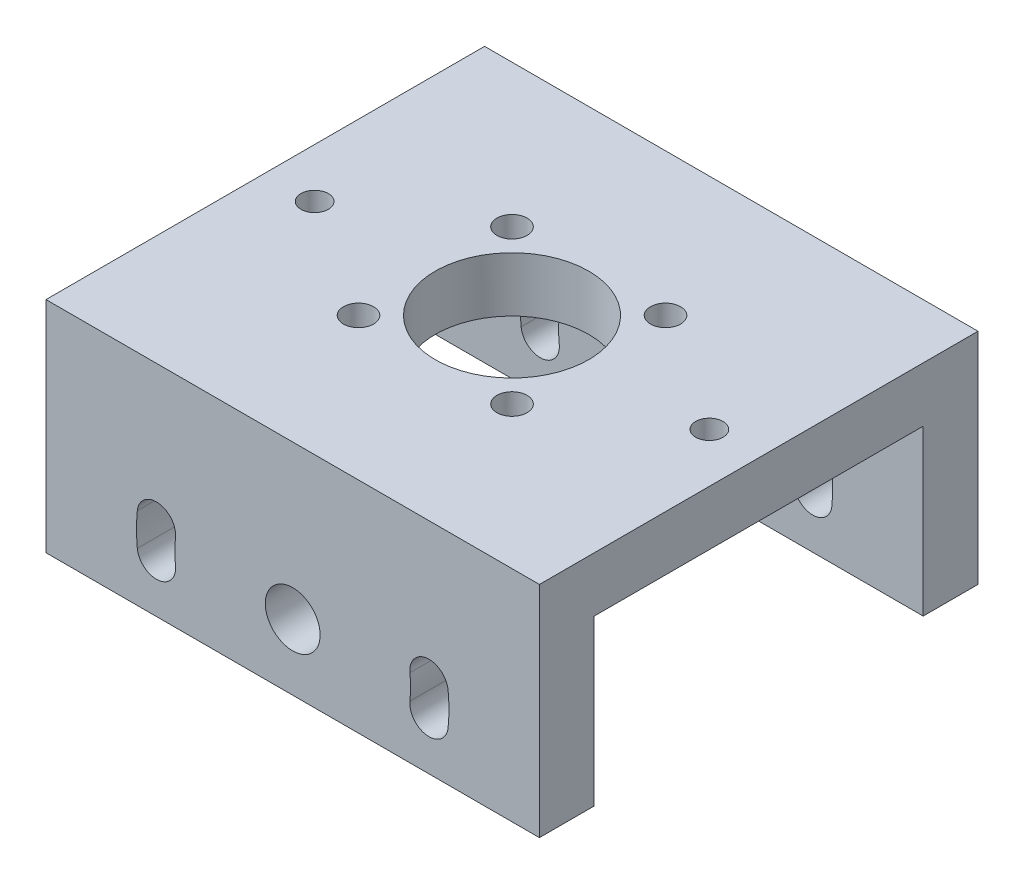
from build123d import *

# Parameters (mm, degrees)
SKETCH_1_W                = 90
SKETCH_1_H                = 80
EXTRUDE_1_DEPTH           = 40
SKETCH_10_W               = 60
SKETCH_10_H               = 30
CUT_EXTRUDE_1_DEPTH       = 107.301458127
HOLE_WIZARD_2_D           = 10
CUT_EXTRUDE_2_DEPTH       = 101.124921973
HOLE_WIZARD_1_D           = 5.5
HOLE_WIZARD_1_CBORE_D     = 10
HOLE_WIZARD_1_CBORE_DEPTH = 5.7
HOLE_WIZARD_1_2_D         = 28
HOLE_WIZARD_M6_1_D        = 5


with BuildPart() as part:
    # 草图1 → 凸台-拉伸1 (new body)
    with BuildSketch(Plane(origin=(0, 0, 0), x_dir=(1, 0, 0), z_dir=(0, 1, 0))):
        Rectangle(SKETCH_1_W, SKETCH_1_H)
    extrude(amount=EXTRUDE_1_DEPTH)

    # 草图10 → 切除-拉伸1 (cut, through all)
    with BuildSketch(Plane(origin=(45, 0, 0), x_dir=(0, 0, -1), z_dir=(1, 0, 0))):
        with Locations((0, 15)):
            Rectangle(SKETCH_10_W, SKETCH_10_H)
    extrude(amount=-CUT_EXTRUDE_1_DEPTH, mode=Mode.SUBTRACT)

    # 孔2 (through all)
    with Locations(Plane.XY.offset(40)):
        with Locations((0, 12)):
            Hole(HOLE_WIZARD_2_D / 2)

    # 草图13 → 切除-拉伸2 (cut, through all)
    with BuildSketch(Plane.XY.offset(40)):
        with BuildLine():
            ThreePointArc((-28.343874018, 14.979061203), (-28.5, 12), (-28.343874018, 9.020938797))
            ThreePointArc((-28.343874018, 9.020938797), (-24.497197763, 5.905961785), (-21.38222075, 9.75263804))
            ThreePointArc((-21.38222075, 9.75263804), (-21.5, 12), (-21.38222075, 14.24736196))
            ThreePointArc((-21.38222075, 14.24736196), (-24.497197763, 18.094038215), (-28.343874018, 14.979061203))
        make_face()
        with BuildLine():
            ThreePointArc((21.38222075, 9.75263804), (24.497197763, 5.905961785), (28.343874018, 9.020938797))
            ThreePointArc((28.343874018, 9.020938797), (28.5, 12), (28.343874018, 14.979061203))
            ThreePointArc((28.343874018, 14.979061203), (24.497197763, 18.094038215), (21.38222075, 14.24736196))
            ThreePointArc((21.38222075, 14.24736196), (21.5, 12), (21.38222075, 9.75263804))
        make_face()
    extrude(amount=-CUT_EXTRUDE_2_DEPTH, mode=Mode.SUBTRACT)

    # Hole Wizard 1 (through all)
    with Locations(Plane(origin=(-40.148551056, 30, -46.468490431), x_dir=(-1, 0, 0), z_dir=(0, -1, 0))):
        with Locations((-26.148551056, -60.468490431), (-54.148551056, -60.468490431), (-54.148551056, -32.468490431), (-26.148551056, -32.468490431)):
            CounterBoreHole(HOLE_WIZARD_1_D / 2, HOLE_WIZARD_1_CBORE_D / 2, HOLE_WIZARD_1_CBORE_DEPTH)

    # Hole Wizard 1 2 (through all)
    with Locations(Plane(origin=(0, 0, 0), x_dir=(-1, 0, 0), z_dir=(0, -1, 0))):
        with Locations((0, 0)):
            Hole(HOLE_WIZARD_1_2_D / 2)

    # M6 螺纹孔1 (through all)
    with Locations(Plane(origin=(0, 40, 0), x_dir=(1, 0, 0), z_dir=(0, 1, 0))):
        with Locations((-36, 0), (36, 0)):
            Hole(HOLE_WIZARD_M6_1_D / 2)


solid = part.part
